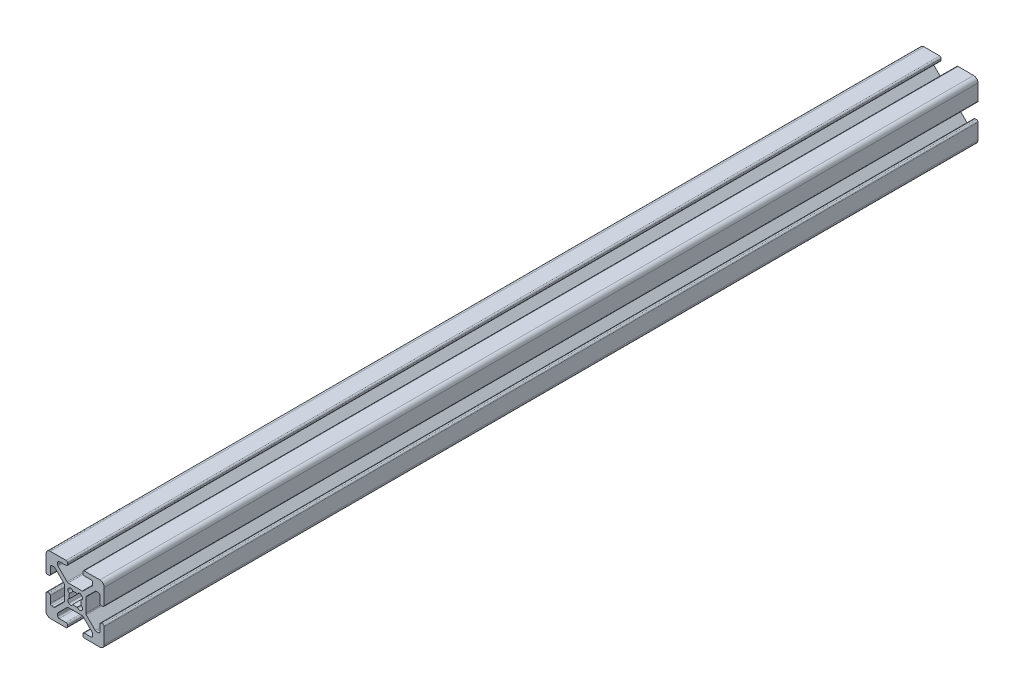
from build123d import *

# Parameters (mm, degrees)
BOSS_EXTRUDE1_DEPTH = 300


with BuildPart() as part:
    # Sketch2 → Boss-Extrude1 (new body)
    with BuildSketch(Plane.XY):
        with BuildLine():
            Line((-10, -3.138), (-10, -8.5))
            ThreePointArc((-10, -8.5), (-9.560660172, -9.560660172), (-8.5, -10))
            Line((-8.5, -10), (-3.138, -10))
            ThreePointArc((-3.138, -10), (-2.778789755, -9.851210245), (-2.63, -9.492))
            Line((-2.63, -9.492), (-2.63, -9.008))
            ThreePointArc((-2.63, -9.008), (-2.778789755, -8.648789755), (-3.138, -8.5))
            Line((-3.138, -8.5), (-5.487, -8.5))
            ThreePointArc((-5.487, -8.5), (-5.846210245, -8.351210245), (-5.995, -7.992))
            Line((-5.995, -7.992), (-5.995, -7.266240833))
            ThreePointArc((-5.995, -7.266240833), (-5.956330803, -7.07183765), (-5.846210245, -6.907030588))
            Line((-5.846210245, -6.907030588), (-2.742969412, -3.803789755))
            ThreePointArc((-2.742969412, -3.803789755), (-2.57816235, -3.693669197), (-2.383759167, -3.655))
            Line((-2.383759167, -3.655), (2.38407951, -3.655))
            ThreePointArc((2.38407951, -3.655), (2.578482694, -3.693669197), (2.743289755, -3.803789755))
            Line((2.743289755, -3.803789755), (5.846210245, -6.906710245))
            ThreePointArc((5.846210245, -6.906710245), (5.956330803, -7.071517306), (5.995, -7.26592049))
            Line((5.995, -7.26592049), (5.995, -7.992))
            ThreePointArc((5.995, -7.992), (5.846210245, -8.351210245), (5.487, -8.5))
            Line((5.487, -8.5), (3.138, -8.5))
            ThreePointArc((3.138, -8.5), (2.778789755, -8.648789755), (2.63, -9.008))
            Line((2.63, -9.008), (2.63, -9.492))
            ThreePointArc((2.63, -9.492), (2.778789755, -9.851210245), (3.138, -10))
            Line((3.138, -10), (8.5, -10))
            ThreePointArc((8.5, -10), (9.560660172, -9.560660172), (10, -8.5))
            Line((10, -8.5), (10, -3.138))
            ThreePointArc((10, -3.138), (9.851210245, -2.778789755), (9.492, -2.63))
            Line((9.492, -2.63), (9.008, -2.63))
            ThreePointArc((9.008, -2.63), (8.648789755, -2.778789755), (8.5, -3.138))
            Line((8.5, -3.138), (8.5, -5.487))
            ThreePointArc((8.5, -5.487), (8.351210245, -5.846210245), (7.992, -5.995))
            Line((7.992, -5.995), (7.266240833, -5.995))
            ThreePointArc((7.266240833, -5.995), (7.07183765, -5.956330803), (6.907030588, -5.846210245))
            Line((6.907030588, -5.846210245), (3.803789755, -2.742969412))
            ThreePointArc((3.803789755, -2.742969412), (3.693669197, -2.57816235), (3.655, -2.383759167))
            Line((3.655, -2.383759167), (3.655, 2.38407951))
            ThreePointArc((3.655, 2.38407951), (3.693669197, 2.578482694), (3.803789755, 2.743289755))
            Line((3.803789755, 2.743289755), (6.906710245, 5.846210245))
            ThreePointArc((6.906710245, 5.846210245), (7.071517306, 5.956330803), (7.26592049, 5.995))
            Line((7.26592049, 5.995), (7.992, 5.995))
            ThreePointArc((7.992, 5.995), (8.351210245, 5.846210245), (8.5, 5.487))
            Line((8.5, 5.487), (8.5, 3.138))
            ThreePointArc((8.5, 3.138), (8.648789755, 2.778789755), (9.008, 2.63))
            Line((9.008, 2.63), (9.492, 2.63))
            ThreePointArc((9.492, 2.63), (9.851210245, 2.778789755), (10, 3.138))
            Line((10, 3.138), (10, 8.5))
            ThreePointArc((10, 8.5), (9.560660172, 9.560660172), (8.5, 10))
            Line((8.5, 10), (3.138, 10))
            ThreePointArc((3.138, 10), (2.778789755, 9.851210245), (2.63, 9.492))
            Line((2.63, 9.492), (2.63, 9.008))
            ThreePointArc((2.63, 9.008), (2.778789755, 8.648789755), (3.138, 8.5))
            Line((3.138, 8.5), (5.487, 8.5))
            ThreePointArc((5.487, 8.5), (5.846210245, 8.351210245), (5.995, 7.992))
            Line((5.995, 7.992), (5.995, 7.266240833))
            ThreePointArc((5.995, 7.266240833), (5.956330803, 7.07183765), (5.846210245, 6.907030588))
            Line((5.846210245, 6.907030588), (2.742969412, 3.803789755))
            ThreePointArc((2.742969412, 3.803789755), (2.57816235, 3.693669197), (2.383759167, 3.655))
            Line((2.383759167, 3.655), (-2.38407951, 3.655))
            ThreePointArc((-2.38407951, 3.655), (-2.578482694, 3.693669197), (-2.743289755, 3.803789755))
            Line((-2.743289755, 3.803789755), (-5.846210245, 6.906710245))
            ThreePointArc((-5.846210245, 6.906710245), (-5.956330803, 7.071517306), (-5.995, 7.26592049))
            Line((-5.995, 7.26592049), (-5.995, 7.992))
            ThreePointArc((-5.995, 7.992), (-5.846210245, 8.351210245), (-5.487, 8.5))
            Line((-5.487, 8.5), (-3.138, 8.5))
            ThreePointArc((-3.138, 8.5), (-2.778789755, 8.648789755), (-2.63, 9.008))
            Line((-2.63, 9.008), (-2.63, 9.492))
            ThreePointArc((-2.63, 9.492), (-2.778789755, 9.851210245), (-3.138, 10))
            Line((-3.138, 10), (-8.5, 10))
            ThreePointArc((-8.5, 10), (-9.560660172, 9.560660172), (-10, 8.5))
            Line((-10, 8.5), (-10, 3.138))
            ThreePointArc((-10, 3.138), (-9.851210245, 2.778789755), (-9.492, 2.63))
            Line((-9.492, 2.63), (-9.008, 2.63))
            ThreePointArc((-9.008, 2.63), (-8.648789755, 2.778789755), (-8.5, 3.138))
            Line((-8.5, 3.138), (-8.5, 5.487))
            ThreePointArc((-8.5, 5.487), (-8.351210245, 5.846210245), (-7.992, 5.995))
            Line((-7.992, 5.995), (-7.266240833, 5.995))
            ThreePointArc((-7.266240833, 5.995), (-7.07183765, 5.956330803), (-6.907030588, 5.846210245))
            Line((-6.907030588, 5.846210245), (-3.803789755, 2.742969412))
            ThreePointArc((-3.803789755, 2.742969412), (-3.693669197, 2.57816235), (-3.655, 2.383759167))
            Line((-3.655, 2.383759167), (-3.655, -2.38407951))
            ThreePointArc((-3.655, -2.38407951), (-3.693669197, -2.578482694), (-3.803789755, -2.743289755))
            Line((-3.803789755, -2.743289755), (-6.906710245, -5.846210245))
            ThreePointArc((-6.906710245, -5.846210245), (-7.071517306, -5.956330803), (-7.26592049, -5.995))
            Line((-7.26592049, -5.995), (-7.992, -5.995))
            ThreePointArc((-7.992, -5.995), (-8.351210245, -5.846210245), (-8.5, -5.487))
            Line((-8.5, -5.487), (-8.5, -3.138))
            ThreePointArc((-8.5, -3.138), (-8.648789755, -2.778789755), (-9.008, -2.63))
            Line((-9.008, -2.63), (-9.492, -2.63))
            ThreePointArc((-9.492, -2.63), (-9.851210245, -2.778789755), (-10, -3.138))
        make_face()
        with BuildLine():
            Line((-2.124493037, 2.304493037), (-2.304493037, 2.124493037))
            ThreePointArc((-2.304493037, 2.124493037), (-2.506016078, 1.35638567), (-1.935777391, 0.803729988))
            ThreePointArc((-1.935777391, 0.803729988), (-2.096, 0), (-1.935777391, -0.803729988))
            ThreePointArc((-1.935777391, -0.803729988), (-2.506016078, -1.35638567), (-2.304493037, -2.124493037))
            Line((-2.304493037, -2.124493037), (-2.124493037, -2.304493037))
            ThreePointArc((-2.124493037, -2.304493037), (-1.35638567, -2.506016078), (-0.803729988, -1.935777391))
            ThreePointArc((-0.803729988, -1.935777391), (0, -2.096), (0.803729988, -1.935777391))
            ThreePointArc((0.803729988, -1.935777391), (1.35638567, -2.506016078), (2.124493037, -2.304493037))
            Line((2.124493037, -2.304493037), (2.304493037, -2.124493037))
            ThreePointArc((2.304493037, -2.124493037), (2.506016078, -1.35638567), (1.935777391, -0.803729988))
            ThreePointArc((1.935777391, -0.803729988), (2.096, 0), (1.935777391, 0.803729988))
            ThreePointArc((1.935777391, 0.803729988), (2.506016078, 1.35638567), (2.304493037, 2.124493037))
            Line((2.304493037, 2.124493037), (2.124493037, 2.304493037))
            ThreePointArc((2.124493037, 2.304493037), (1.35638567, 2.506016078), (0.803729988, 1.935777391))
            ThreePointArc((0.803729988, 1.935777391), (0, 2.096), (-0.803729988, 1.935777391))
            ThreePointArc((-0.803729988, 1.935777391), (-1.35638567, 2.506016078), (-2.124493037, 2.304493037))
        make_face(mode=Mode.SUBTRACT)
    extrude(amount=-BOSS_EXTRUDE1_DEPTH)


solid = part.part
